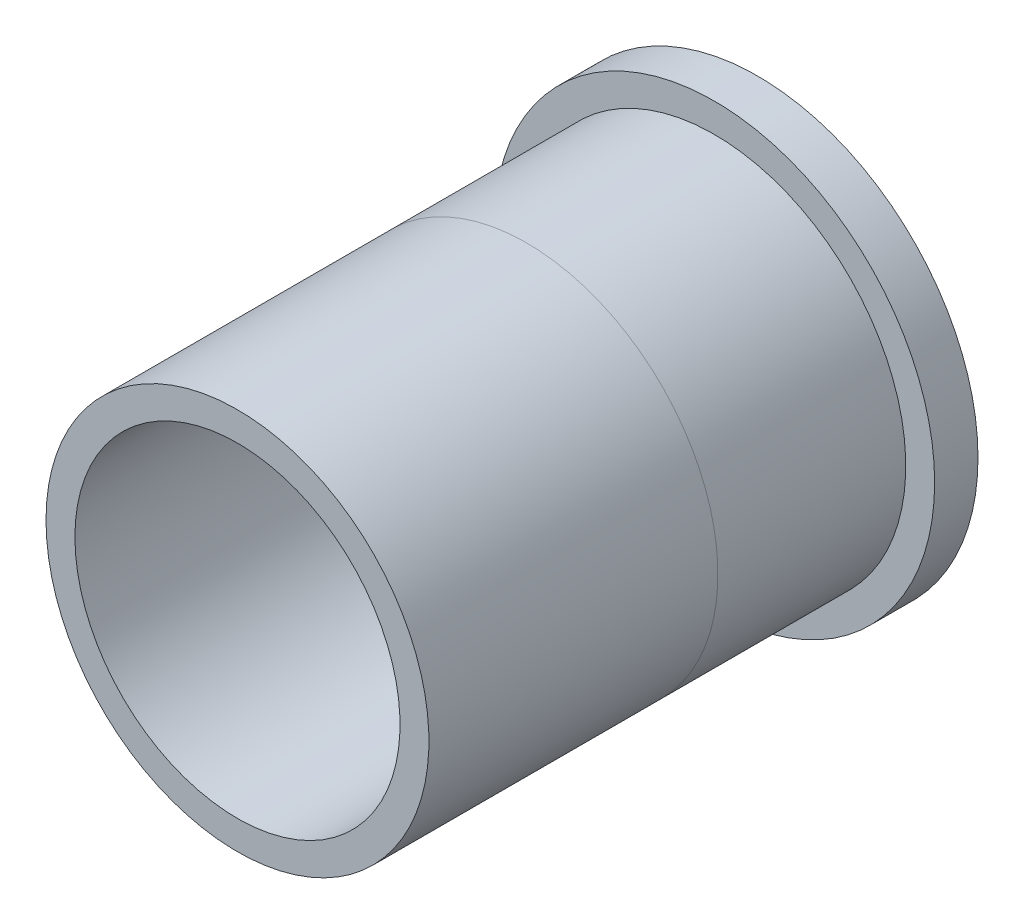
from build123d import *


with BuildPart() as part:
    # Croquis1 → Revolución1 (revolve)
    with BuildSketch(Plane(origin=(0, 0, 0), x_dir=(1, 0, 0), z_dir=(0, 1, 0)), mode=Mode.PRIVATE) as revoluci_n1_sk:
        Polygon((11.25, -6.580508167), (11.25, 20.143587236), (4, 20.143587236), (4, 26.143587236), (8.75, 26.143587236), (8.75, 26.443587236), (12.25, 26.443587236), (12.25, 29.419491833), (15.25, 29.419491833), (15.25, 26.419491833), (13.25, 26.419491833), (13.25, -6.580508167), align=None)
    revolve(revoluci_n1_sk.sketch.rotate(Axis((0, 0, -41.745454545), (0, 0, 1)), 180), axis=Axis((0, 0, -41.745454545), (0, 0, 1)))


with BuildPart() as body_2:
    # Partir1: the piece on the far side of the plane
    add(part.part)
    split(bisect_by=Plane(origin=(0, 0, -13.419491833), x_dir=(-1, 0, 0), z_dir=(0, 0, -1)), keep=Keep.BOTTOM)


with BuildPart() as part_1:
    add(part.part)

    # Partir1
    split(bisect_by=Plane(origin=(0, 0, -13.419491833), x_dir=(-1, 0, 0), z_dir=(0, 0, -1)), keep=Keep.TOP)


solid = Compound([body_2.part, part_1.part])
